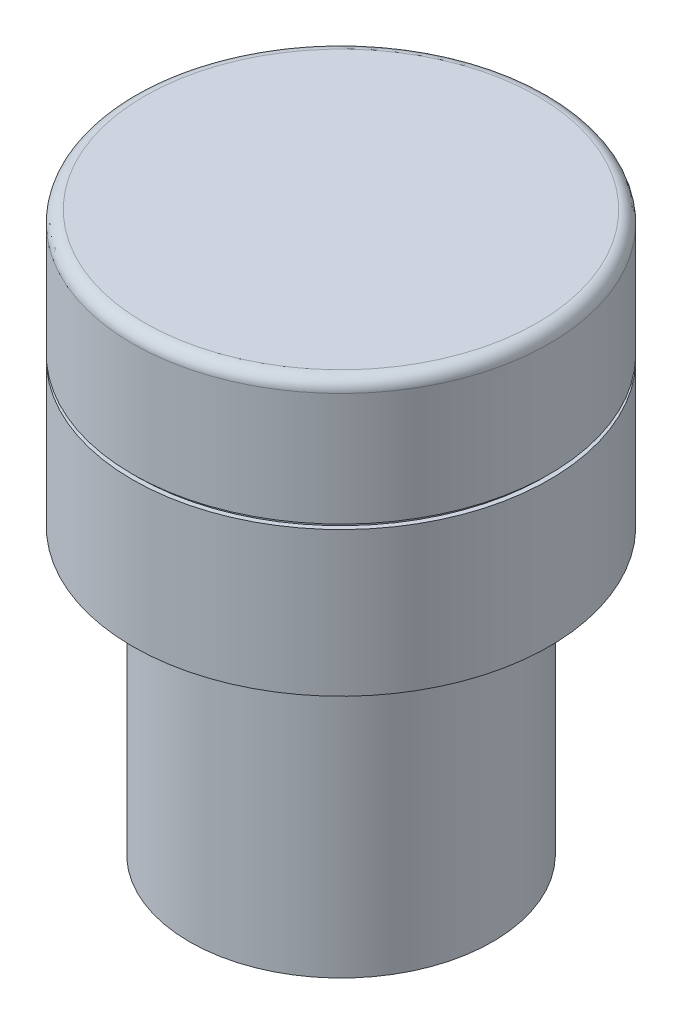
from build123d import *

# Parameters (mm, degrees)
SKETCH1_R      = 8
EXTRUDE1_DEPTH = 15
SKETCH2_R      = 11
EXTRUDE2_DEPTH = 7.62
SKETCH3_R      = 10.75
EXTRUDE3_DEPTH = 0.25
SKETCH4_R      = 11
EXTRUDE4_DEPTH = 6.604
FILLET1_R      = 0.635


with BuildPart() as part:
    # Sketch1 → Extrude1 (new body)
    with BuildSketch(Plane(origin=(0, 0, 0), x_dir=(1, 0, 0), z_dir=(0, 1, 0))):
        with Locations(Location((0, 0, 0), (0, 0, 270))):
            Circle(SKETCH1_R)
    extrude(amount=EXTRUDE1_DEPTH)

    # Sketch2 → Extrude2 (add)
    with BuildSketch(Plane(origin=(0, 15, 0), x_dir=(-1, 0, 0), z_dir=(0, 1, 0))):
        with Locations(Location((0, 0, 0), (0, 0, 270))):
            Circle(SKETCH2_R)
    extrude(amount=EXTRUDE2_DEPTH)

    # Sketch3 → Extrude3 (add)
    with BuildSketch(Plane(origin=(0, 22.62, 0), x_dir=(-1, 0, 0), z_dir=(0, 1, 0))):
        with Locations(Location((0, 0, 0), (0, 0, 90))):
            Circle(SKETCH3_R)
    extrude(amount=EXTRUDE3_DEPTH)

    # Sketch4 → Extrude4 (add)
    with BuildSketch(Plane(origin=(0, 22.87, 0), x_dir=(-1, 0, 0), z_dir=(0, 1, 0))):
        with Locations(Location((0, 0, 0), (0, 0, 270))):
            Circle(SKETCH4_R)
    extrude(amount=EXTRUDE4_DEPTH)

    # Fillet1
    fillet1_edges = [part.edges().sort_by_distance(p)[0] for p in [
        (0, 29.474, 11),
    ]]
    fillet(fillet1_edges, radius=FILLET1_R)


solid = part.part
